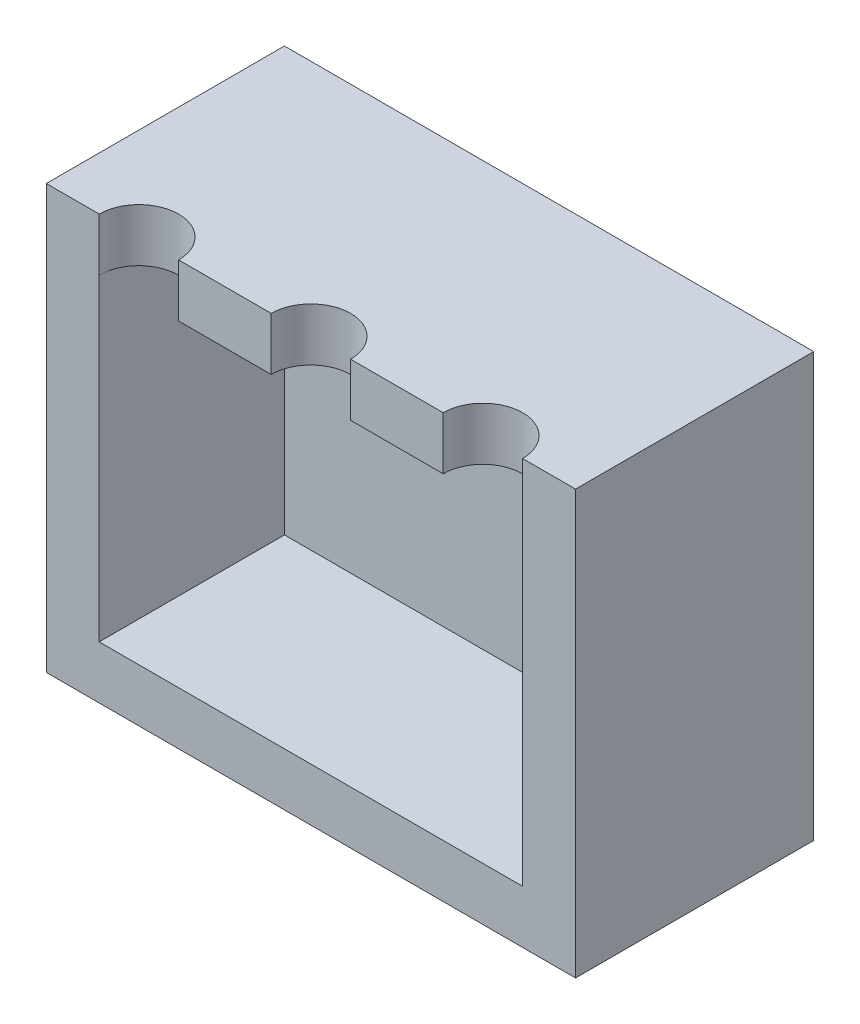
from build123d import *

# Parameters (mm, degrees)
SKETCH1_W           = 20
SKETCH1_H           = 16
BOSS_EXTRUDE1_DEPTH = 9
SKETCH2_W           = 16
SKETCH2_H           = 12
CUT_EXTRUDE1_DEPTH  = 7
SKETCH4_R           = 1.5
CUT_EXTRUDE3_DEPTH  = 7


with BuildPart() as part:
    # Sketch1 → Boss-Extrude1 (new body)
    with BuildSketch(Plane.XY):
        with Locations((10, 8)):
            Rectangle(SKETCH1_W, SKETCH1_H)
    extrude(amount=BOSS_EXTRUDE1_DEPTH)

    # Sketch2 → Cut-Extrude1 (cut)
    with BuildSketch(Plane.XY.offset(9)):
        with Locations((10, 8)):
            Rectangle(SKETCH2_W, SKETCH2_H)
    extrude(amount=-CUT_EXTRUDE1_DEPTH, mode=Mode.SUBTRACT)

    # Sketch4 → Cut-Extrude3 (cut)
    with BuildSketch(Plane(origin=(0, 16, 0), x_dir=(1, 0, 0), z_dir=(0, 1, 0))):
        with Locations((3.5, -9)):
            Circle(SKETCH4_R)
        with Locations((10, -9)):
            Circle(SKETCH4_R)
        with Locations((16.5, -9)):
            Circle(SKETCH4_R)
    extrude(amount=-CUT_EXTRUDE3_DEPTH, mode=Mode.SUBTRACT)


solid = part.part
